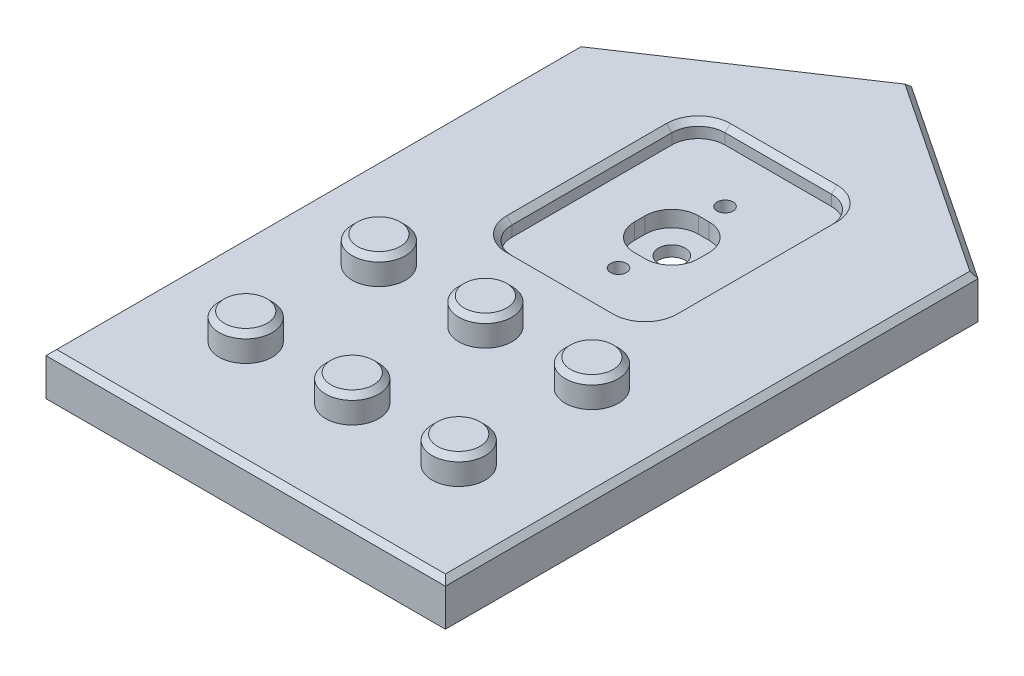
from build123d import *

# Parameters (mm, degrees)
BOSS_EXTRUDE1_DEPTH       = 8
SKETCH2_W                 = 5
SKETCH2_H                 = 5
LPATTERN1_COUNT           = 2
LPATTERN1_PITCH           = 20
LPATTERN1_COL_COUNT       = 2
LPATTERN1_COL_PITCH       = 20
LPATTERN2_COUNT           = 2
LPATTERN2_PITCH           = 25
LPATTERN2_COPY_1_SKETCH_W = 5
LPATTERN2_COPY_1_SKETCH_H = 5
LPATTERN2_COPY_2_SKETCH_W = 5
LPATTERN2_COPY_2_SKETCH_H = 5
SKETCH3_W                 = 30
SKETCH3_H                 = 40
CUT_EXTRUDE1_DEPTH        = 3
FILLET1_R                 = 5
CHAMFER1_SIZE             = 1
SKETCH4_R                 = 1.5
SKETCH4_R_2               = 2.5
CUT_EXTRUDE2_DEPTH        = 131.748804966
SKETCH5_W                 = 12
SKETCH5_H                 = 12
CUT_EXTRUDE3_DEPTH        = 3
FILLET2_R                 = 5


with BuildPart() as part:
    # Sketch1 → Boss-Extrude1 (new body)
    with BuildSketch(Plane(origin=(0, 0, 0), x_dir=(1, 0, 0), z_dir=(0, 1, 0))):
        Polygon((-37.5, 0), (37.5, 0), (37.5, 100), (0, 125), (-37.5, 100), align=None)
    extrude(amount=BOSS_EXTRUDE1_DEPTH)

    # Sketch2 → Revolve1 (revolve)
    with BuildSketch(Plane(origin=(0, 0, 0), x_dir=(0, 0, -1), z_dir=(1, 0, 0)), mode=Mode.PRIVATE) as revolve1_sk:
        with Locations((17.5, 10.5)):
            Rectangle(SKETCH2_W, SKETCH2_H)
    revolve1 = revolve(revolve1_sk.sketch.rotate(Axis((0, 8, -20), (0, 1, 0)), 180), axis=Axis((0, 8, -20), (0, 1, 0)))

    # LPattern1: Revolve1 ×2
    with Locations(*[(-i * LPATTERN1_PITCH, 0, 0) for i in range(1, LPATTERN1_COUNT)]):
        add(revolve1)

    # LPattern1 col: Revolve1 ×2
    with Locations(*[(i * LPATTERN1_COL_PITCH, 0, 0) for i in range(1, LPATTERN1_COL_COUNT)]):
        add(revolve1)

    # LPattern2: Revolve1 ×2
    with Locations(*[(0, 0, -i * LPATTERN2_PITCH) for i in range(1, LPATTERN2_COUNT)]):
        add(revolve1)

    # LPattern2 copy 1 sketch → LPattern2 copy 1 (revolve)
    with BuildSketch(Plane(origin=(-20, 0, -25), x_dir=(0, 0, -1), z_dir=(1, 0, 0))):
        with Locations((17.5, 10.5)):
            Rectangle(LPATTERN2_COPY_1_SKETCH_W, LPATTERN2_COPY_1_SKETCH_H)
    revolve(axis=Axis((-20, 8, -45), (0, 1, 0)))

    # LPattern2 copy 2 sketch → LPattern2 copy 2 (revolve)
    with BuildSketch(Plane(origin=(20, 0, -25), x_dir=(0, 0, -1), z_dir=(1, 0, 0))):
        with Locations((17.5, 10.5)):
            Rectangle(LPATTERN2_COPY_2_SKETCH_W, LPATTERN2_COPY_2_SKETCH_H)
    revolve(axis=Axis((20, 8, -45), (0, 1, 0)))

    # Sketch3 → Cut-Extrude1 (cut)
    with BuildSketch(Plane(origin=(0, 8, 0), x_dir=(1, 0, 0), z_dir=(0, 1, 0))):
        with Locations((0, 80)):
            Rectangle(SKETCH3_W, SKETCH3_H)
    extrude(amount=-CUT_EXTRUDE1_DEPTH, mode=Mode.SUBTRACT)

    # Fillet1
    fillet1_edges = [part.edges().sort_by_distance(p)[0] for p in [
        (-15, 6.5, -60),
        (-15, 6.5, -100),
        (15, 6.5, -100),
        (15, 6.5, -60),
    ]]
    fillet(fillet1_edges, radius=FILLET1_R)

    # Chamfer1
    chamfer1_edges = [part.edges().sort_by_distance(p)[0] for p in [
        (18.75, 8, -112.5),
        (-18.75, 8, -112.5),
        (0, 13, -15),
        (20, 13, -15),
        (-37.5, 8, -50),
        (-20, 13, -15),
        (0, 8, 0),
        (0, 13, -40),
        (20, 13, -50),
        (-20, 13, -50),
        (37.5, 8, -50),
        (15, 8, -80),
        (0, 8, -60),
        (0, 8, -100),
        (-15, 8, -80),
        (13.535533906, 8, -61.464466094),
        (13.535533906, 8, -98.535533906),
        (-13.535533906, 8, -61.464466094),
        (-13.535533906, 8, -98.535533906),
    ]]
    chamfer(chamfer1_edges, length=CHAMFER1_SIZE)

    # Sketch4 → Cut-Extrude2 (cut, through all)
    with BuildSketch(Plane(origin=(0, 5, 0), x_dir=(1, 0, 0), z_dir=(0, 1, 0))):
        with Locations(Location((0, 90, 0), (0, 0, 270))):
            Circle(SKETCH4_R)
        with Locations(Location((0, 80, 0), (0, 0, 270))):
            Circle(SKETCH4_R_2)
        with Locations(Location((0, 70, 0), (0, 0, 270))):
            Circle(SKETCH4_R)
    extrude(amount=-CUT_EXTRUDE2_DEPTH, mode=Mode.SUBTRACT)

    # Sketch5 → Cut-Extrude3 (cut)
    with BuildSketch(Plane(origin=(0, 5, 0), x_dir=(1, 0, 0), z_dir=(0, 1, 0))):
        with Locations((0, 80)):
            Rectangle(SKETCH5_W, SKETCH5_H)
    extrude(amount=-CUT_EXTRUDE3_DEPTH, mode=Mode.SUBTRACT)

    # Fillet2
    fillet2_edges = [part.edges().sort_by_distance(p)[0] for p in [
        (-6, 3.5, -74),
        (-6, 3.5, -86),
        (6, 3.5, -86),
        (6, 3.5, -74),
    ]]
    fillet(fillet2_edges, radius=FILLET2_R)


solid = part.part
